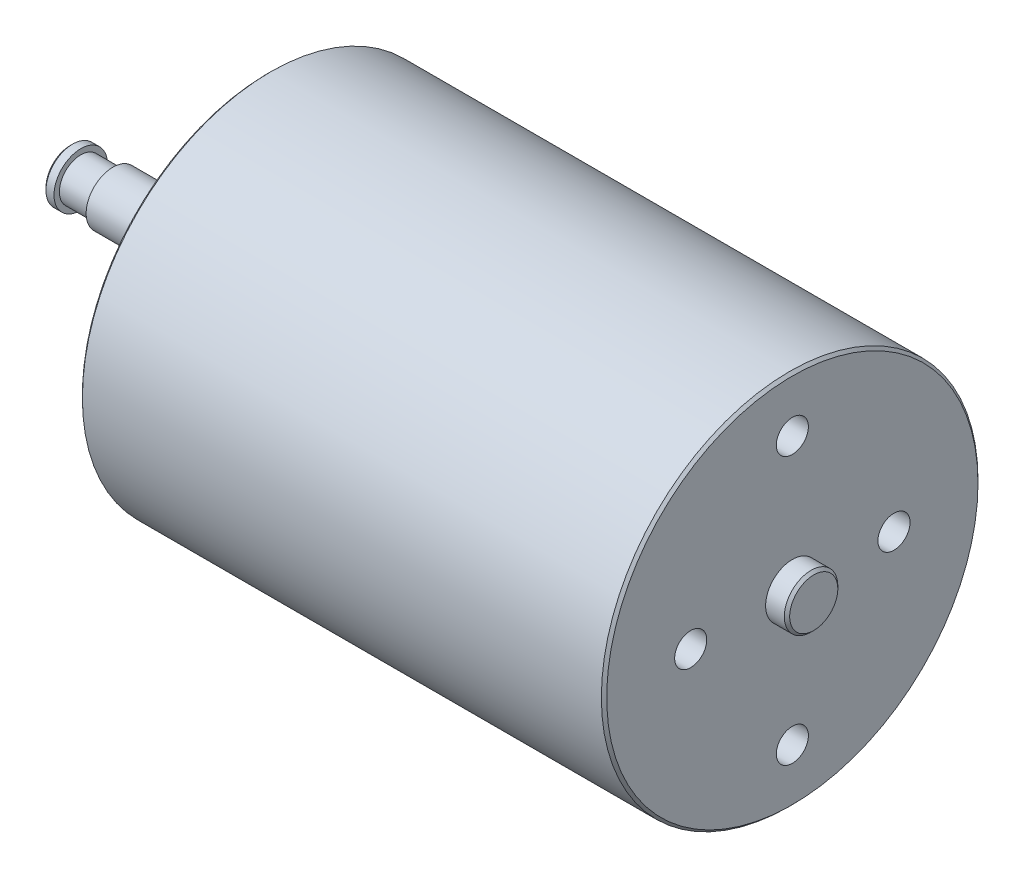
from build123d import *

# Parameters (mm, degrees)
SKETCH1_R                    = 17.6
BOSS_EXTRUDE1_DEPTH          = 49
F_3_0_3_DIAMETER_HOLE1_D     = 3
F_3_0_3_DIAMETER_HOLE1_DEPTH = 5
F_3_0_3_DIAMETER_HOLE1_TIP   = 0.901290929
SKETCH6_R                    = 2.5
BOSS_EXTRUDE2_DEPTH          = 2
BOSS_EXTRUDE3_START          = 14.5
SKETCH7_R                    = 2.5
BOSS_EXTRUDE3_DEPTH          = 14.5
SKETCH8_R                    = 2
BOSS_EXTRUDE4_DEPTH          = 3
BOSS_EXTRUDE5_START          = 18.5
SKETCH7_2_R                  = 2.5
BOSS_EXTRUDE5_DEPTH          = 1
CHAMFER1_SIZE                = 0.25
CUT_EXTRUDE1_DEPTH           = 57.749625549
CUT_EXTRUDE1_DEPTH_BACK      = 57.749625549
SKETCH9_W                    = 8
SKETCH9_H                    = 0.5


with BuildPart() as part:
    # Sketch1 → Boss-Extrude1 (new body)
    with BuildSketch(Plane(origin=(0, 0, 0), x_dir=(0, 0, -1), z_dir=(1, 0, 0))):
        Circle(SKETCH1_R)
    extrude(amount=BOSS_EXTRUDE1_DEPTH)

    # Ø3.0 (3) Diameter Hole1
    with Locations(Plane(origin=(49, 0, 0), x_dir=(0, 0, -1), z_dir=(1, 0, 0))):
        with Locations((0, 12.5), (9.5, 0), (0, -12.5), (-9.5, 0)):
            Hole(F_3_0_3_DIAMETER_HOLE1_D / 2, depth=F_3_0_3_DIAMETER_HOLE1_DEPTH)
            with Locations((0, 0, -(F_3_0_3_DIAMETER_HOLE1_DEPTH + F_3_0_3_DIAMETER_HOLE1_TIP / 2))):  # 118° drill point
                Cone(0, F_3_0_3_DIAMETER_HOLE1_D / 2, F_3_0_3_DIAMETER_HOLE1_TIP, mode=Mode.SUBTRACT)

    # Sketch6 → Boss-Extrude2 (add)
    with BuildSketch(Plane(origin=(49, 0, 0), x_dir=(0, 0, -1), z_dir=(1, 0, 0))):
        Circle(SKETCH6_R)
    extrude(amount=BOSS_EXTRUDE2_DEPTH)

    # Sketch7 → Boss-Extrude3 (add)
    with BuildSketch(Plane.ZY.offset(BOSS_EXTRUDE3_START)):
        Circle(SKETCH7_R)
    extrude(amount=-BOSS_EXTRUDE3_DEPTH)

    # Sketch8 → Boss-Extrude4 (add)
    with BuildSketch(Plane.ZY.offset(14.5)):
        Circle(SKETCH8_R)
    extrude(amount=BOSS_EXTRUDE4_DEPTH)

    # Sketch7<2> → Boss-Extrude5 (add)
    with BuildSketch(Plane.ZY.offset(BOSS_EXTRUDE5_START)):
        Circle(SKETCH7_2_R)
    extrude(amount=-BOSS_EXTRUDE5_DEPTH)

    # Chamfer1
    chamfer1_edges = [part.edges().sort_by_distance(p)[0] for p in [
        (51, 0, 2.5),
        (-18.5, 0, -2.5),
        (0, 0, 17.6),
        (49, 0, 17.6),
    ]]
    chamfer(chamfer1_edges, length=CHAMFER1_SIZE)

    # Sketch9 → Cut-Extrude1 (cut, two sides: drawn at the far end of the back side and taken through both)
    with BuildSketch(Plane.XY.offset(-CUT_EXTRUDE1_DEPTH_BACK)):
        with Locations((-6, -2.25)):
            Rectangle(SKETCH9_W, SKETCH9_H)
    extrude(amount=CUT_EXTRUDE1_DEPTH + CUT_EXTRUDE1_DEPTH_BACK, mode=Mode.SUBTRACT)


solid = part.part
